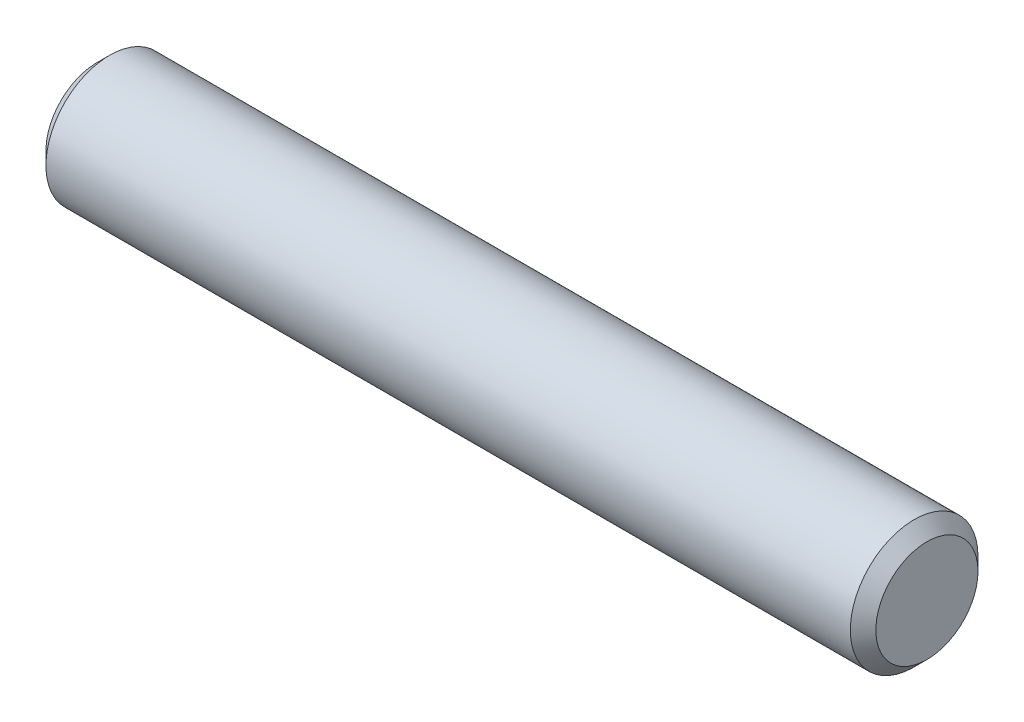
from build123d import *

# Parameters (mm, degrees)
SKIZZE1_R                       = 1.5
AUFSATZ_LINEAR_AUSTRAGEN1_DEPTH = 9.75
FASE1_SIZE                      = 0.3


with BuildPart() as part:
    # Skizze1 → Aufsatz-Linear austragen1 (new, symmetric)
    with BuildSketch(Plane(origin=(0, 0, 0), x_dir=(0, 0, -1), z_dir=(1, 0, 0))):
        Circle(SKIZZE1_R)
    extrude(amount=AUFSATZ_LINEAR_AUSTRAGEN1_DEPTH, both=True)

    # Fase1
    fase1_edges = [part.edges().sort_by_distance(p)[0] for p in [
        (-9.75, 0, 1.5),
        (9.75, 0, 1.5),
    ]]
    chamfer(fase1_edges, length=FASE1_SIZE)


solid = part.part
